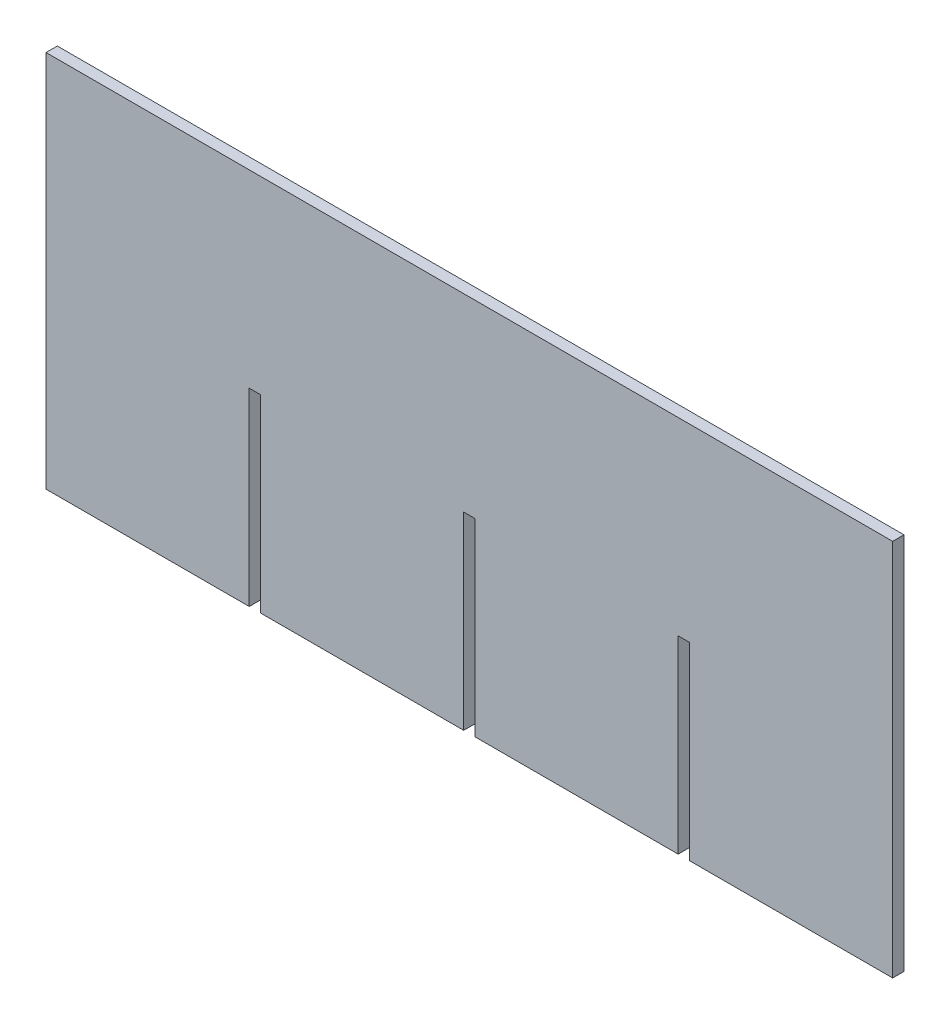
from build123d import *

# Parameters (mm, degrees)
SKETCH1_W           = 150
SKETCH1_H           = 67
BOSS_EXTRUDE1_DEPTH = 2
SKETCH2_W           = 2
SKETCH2_H           = 33.5
CUT_EXTRUDE1_DEPTH  = 83.165990531


with BuildPart() as part:
    # Sketch1 → Boss-Extrude1 (new body)
    with BuildSketch(Plane.XY):
        Rectangle(SKETCH1_W, SKETCH1_H)
    extrude(amount=BOSS_EXTRUDE1_DEPTH)

    # Sketch2 → Cut-Extrude1 (cut, through all)
    with BuildSketch(Plane.XY.offset(2)):
        with Locations((-38, -16.75)):
            Rectangle(SKETCH2_W, SKETCH2_H)
        with Locations((0, -16.75)):
            Rectangle(SKETCH2_W, SKETCH2_H)
        with Locations((38, -16.75)):
            Rectangle(SKETCH2_W, SKETCH2_H)
    extrude(amount=-CUT_EXTRUDE1_DEPTH, mode=Mode.SUBTRACT)


solid = part.part
